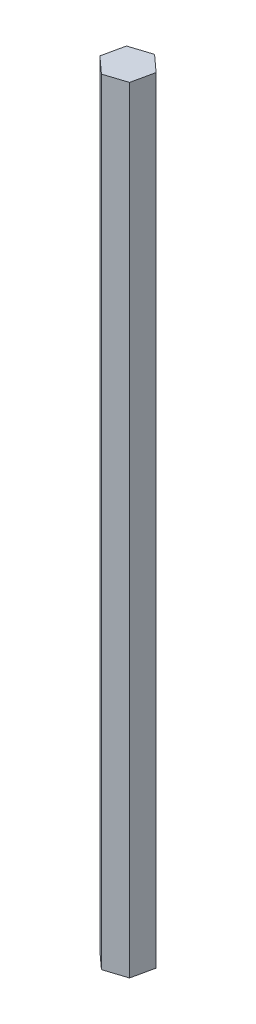
from build123d import *

# Parameters (mm, degrees)
BOSS_EXTRUDE1_DEPTH = 127
SKETCH3_W           = 20.194547067
SKETCH3_H           = 18.170773651
CUT_EXTRUDE1_DEPTH  = 38.1
BOSS_EXTRUDE2_DEPTH = 2.54
SKETCH5_W           = 34.517572909
SKETCH5_H           = 22.340458643
CUT_EXTRUDE2_DEPTH  = 50
BOSS_EXTRUDE3_DEPTH = 25
BOSS_EXTRUDE4_DEPTH = 13.5
BOSS_EXTRUDE5_DEPTH = 20.32


with BuildPart() as part:
    # Sketch2 → Boss-Extrude1 (new body)
    with BuildSketch(Plane(origin=(0, 0, 0), x_dir=(1, 0, 0), z_dir=(0, 1, 0))):
        Polygon((2.137295047, -1.940438924), (2.749116926, 0.880732344), (0.611821879, 2.821171268), (-2.137295047, 1.940438924), (-2.749116926, -0.880732344), (-0.611821879, -2.821171268), align=None)
    extrude(amount=BOSS_EXTRUDE1_DEPTH)

    # Sketch3 → Cut-Extrude1 (cut)
    with BuildSketch(Plane.XZ):
        with Locations((-3.121926418, 0.771419978)):
            Rectangle(SKETCH3_W, SKETCH3_H)
    extrude(amount=-CUT_EXTRUDE1_DEPTH, mode=Mode.SUBTRACT)

    # Sketch4 → Boss-Extrude2 (add)
    with BuildSketch(Plane.XZ.offset(-38.1)):
        Polygon((0.611821879, -2.821171268), (2.749116926, -0.880732344), (2.137295047, 1.940438924), (-0.611821879, 2.821171268), (-2.749116926, 0.880732344), (-2.137295047, -1.940438924), align=None)
    extrude(amount=BOSS_EXTRUDE2_DEPTH)

    # Sketch5 → Cut-Extrude2 (cut)
    with BuildSketch(Plane.XZ.offset(-35.56)):
        with Locations((-1.3482575, -1.032578251)):
            Rectangle(SKETCH5_W, SKETCH5_H)
    extrude(amount=-CUT_EXTRUDE2_DEPTH, mode=Mode.SUBTRACT)

    # Sketch7 → Boss-Extrude3 (add)
    with BuildSketch(Plane.XZ.offset(-85.56)):
        Polygon((0.611821879, -2.821171268), (2.749116926, -0.880732344), (2.137295047, 1.940438924), (-0.611821879, 2.821171268), (-2.749116926, 0.880732344), (-2.137295047, -1.940438924), align=None)
    extrude(amount=BOSS_EXTRUDE3_DEPTH)

    # Sketch8 → Boss-Extrude4 (add)
    with BuildSketch(Plane.XZ.offset(-60.56)):
        Polygon((0.611821879, -2.821171268), (2.749116926, -0.880732344), (2.137295047, 1.940438924), (-0.611821879, 2.821171268), (-2.749116926, 0.880732344), (-2.137295047, -1.940438924), align=None)
    extrude(amount=BOSS_EXTRUDE4_DEPTH)

    # Sketch9 → Boss-Extrude5 (add)
    with BuildSketch(Plane.XZ.offset(-47.06)):
        Polygon((0.611821879, -2.821171268), (2.749116926, -0.880732344), (2.137295047, 1.940438924), (-0.611821879, 2.821171268), (-2.749116926, 0.880732344), (-2.137295047, -1.940438924), align=None)
    extrude(amount=BOSS_EXTRUDE5_DEPTH)


solid = part.part
